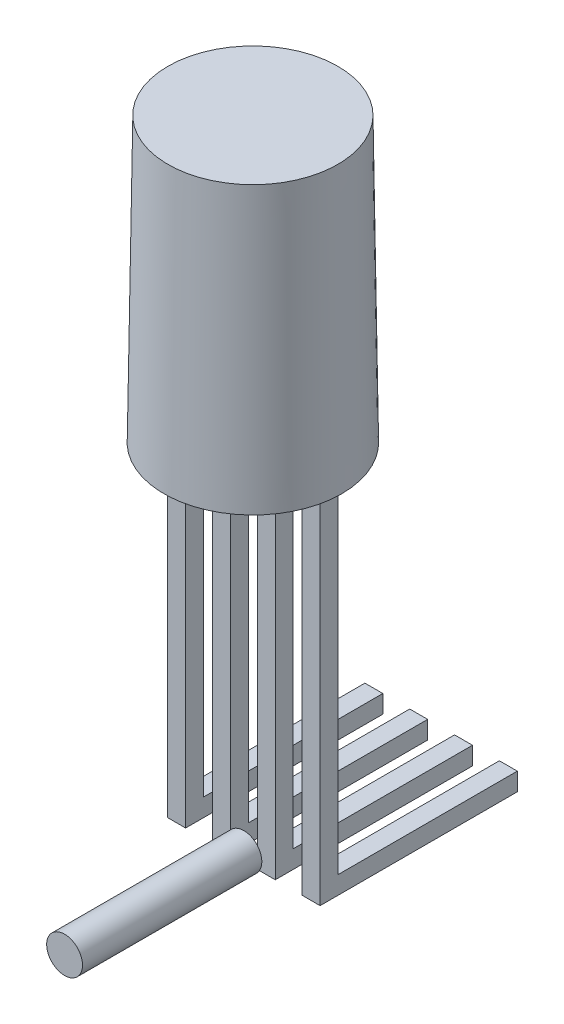
from build123d import *

# Parameters (mm, degrees)
SKETCH3_W           = 0.5
SKETCH3_H           = 0.5
BOSS_EXTRUDE1_DEPTH = 10
SKETCH4_W           = 0.5
SKETCH4_H           = 0.5
BOSS_EXTRUDE2_DEPTH = 5
SKETCH5_R           = 0.5
BOSS_EXTRUDE3_DEPTH = 5


with BuildPart() as part:
    # Sketch2 → Revolve1 (revolve)
    with BuildSketch(Plane.XY, mode=Mode.PRIVATE) as revolve1_sk:
        Polygon((0, 0), (2.48, 0), (2.37, 7.9), (0, 7.9), align=None)
    revolve(revolve1_sk.sketch.rotate(Axis((0, 7.9, 0), (0, -1, 0)), 180), axis=Axis((0, 7.9, 0), (0, -1, 0)))

    # Sketch3 → Boss-Extrude1 (add)
    with BuildSketch(Plane.XZ):
        with Locations((-0.625, 0)):
            Rectangle(SKETCH3_W, SKETCH3_H)
        with Locations((-1.875, 0)):
            Rectangle(SKETCH3_W, SKETCH3_H)
        with Locations((0.625, 0)):
            Rectangle(SKETCH3_W, SKETCH3_H)
        with Locations((1.875, 0)):
            Rectangle(SKETCH3_W, SKETCH3_H)
    extrude(amount=BOSS_EXTRUDE1_DEPTH)

    # Sketch4 → Boss-Extrude2 (add)
    with BuildSketch(Plane.XY.offset(-0.25)):
        with Locations((-1.875, -9.75)):
            Rectangle(SKETCH4_W, SKETCH4_H)
        with Locations((-0.625, -9.75)):
            Rectangle(SKETCH4_W, SKETCH4_H)
        with Locations((0.625, -9.75)):
            Rectangle(SKETCH4_W, SKETCH4_H)
        with Locations((1.875, -9.75)):
            Rectangle(SKETCH4_W, SKETCH4_H)
    extrude(amount=-BOSS_EXTRUDE2_DEPTH)

    # Sketch5 → Boss-Extrude3 (add)
    with BuildSketch(Plane.XY.offset(0.25)):
        with Locations(Location((0, -9.75, 0), (0, 0, 210))):
            Circle(SKETCH5_R)
    extrude(amount=BOSS_EXTRUDE3_DEPTH)


solid = part.part
